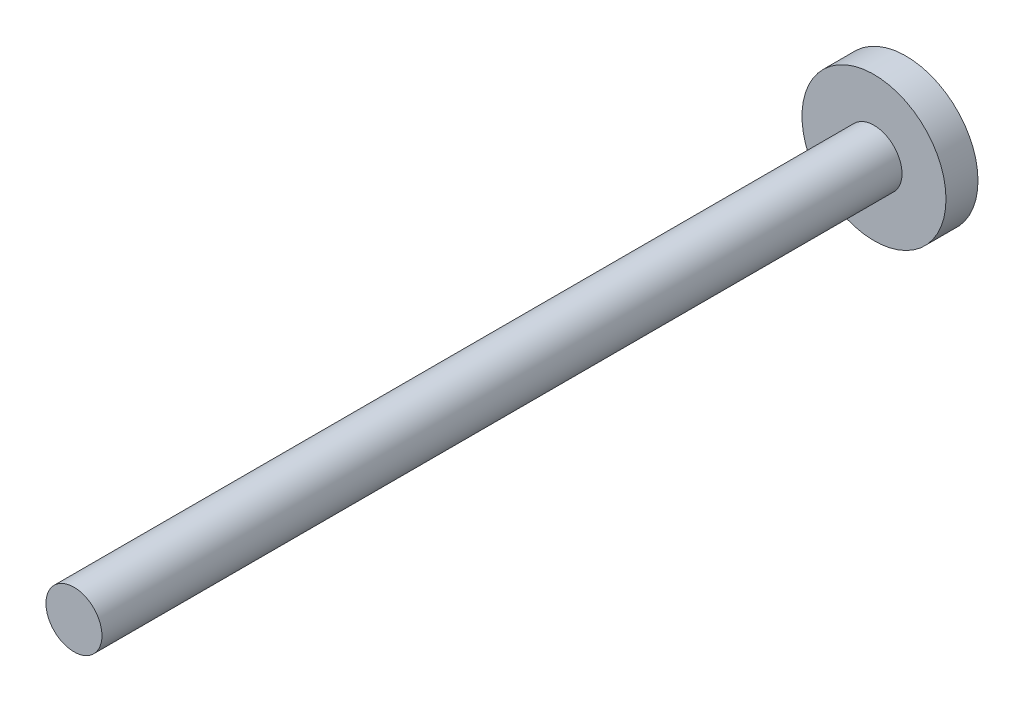
from build123d import *

# Parameters (mm, degrees)
SKETCH1_R           = 4.5
BOSS_EXTRUDE1_DEPTH = 2
SKETCH2_R           = 1.75
BOSS_EXTRUDE2_DEPTH = 50


with BuildPart() as part:
    # Sketch1 → Boss-Extrude1 (new body)
    with BuildSketch(Plane.XY):
        Circle(SKETCH1_R)
    extrude(amount=BOSS_EXTRUDE1_DEPTH)

    # Sketch2 → Boss-Extrude2 (add)
    with BuildSketch(Plane.XY.offset(2)):
        Circle(SKETCH2_R)
    extrude(amount=BOSS_EXTRUDE2_DEPTH)


solid = part.part
